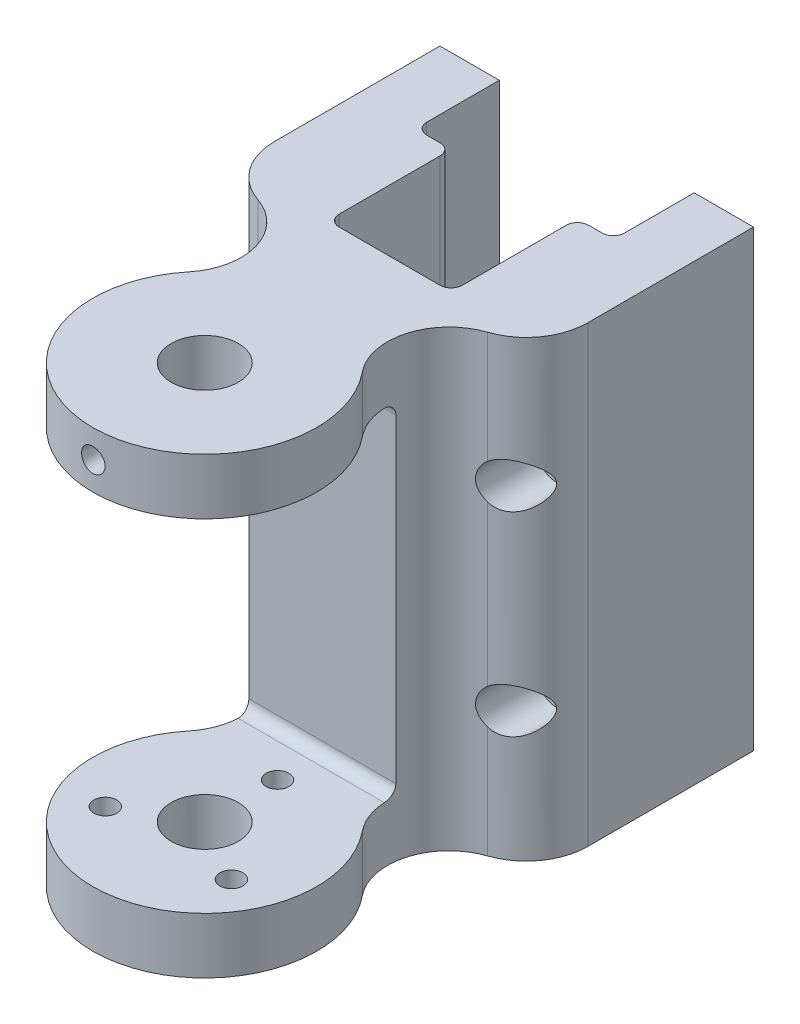
from build123d import *

# Parameters (mm, degrees)
ESQUISSE3_R                         = 3
BOSS_EXTRU_1_DEPTH                  = 20.25
ENL_V_MAT_EXTRU_2_DEPTH             = 55.83668936
ENL_V_MAT_EXTRU_2_DEPTH_BACK        = 55.83668936
ESQUISSE5_W                         = 24.5
ESQUISSE5_H                         = 30.5
ENL_V_MAT_EXTRU_3_DEPTH             = 66.094162565
ENL_V_MAT_EXTRU_3_DEPTH_BACK        = 66.094162565
ENL_V_MAT_EXTRU_6_DEPTH             = 66.094162565
TROU_TARAUD_M2_51_D                 = 2.05
TROU_TARAUD_M2_51_DEPTH             = 5
DIAM_TRE_DU_PER_AGE_2_1_2_1_1_D     = 2.1
DIAM_TRE_DU_PER_AGE_2_1_2_1_1_DEPTH = 1.8
DIAM_TRE_DU_PER_AGE_2_1_2_1_1_TIP   = 0.63090365
ESQUISSE16_R                        = 1.025
ENL_V_MAT_EXTRU_7_DEPTH             = 52.293883791
ENL_V_START                         = -15
ESQUISSE17_R                        = 2
ENL_V_MAT_EXTRU_9_DEPTH             = 10
CONG_1_R                            = 1


with BuildPart() as part:
    # Esquisse3 → Boss.-Extru.1 (new, symmetric)
    with BuildSketch(Plane(origin=(0, 0, 0), x_dir=(1, 0, 0), z_dir=(0, 1, 0))):
        with BuildLine():
            Line((-14, 0), (-14, -35))
            ThreePointArc((-14, -35), (0, -49), (14, -35))
            Line((14, -35), (14, 0))
            Line((14, 0), (-14, 0))
        make_face()
        with Locations(Location((0, -35, 0), (0, 0, 270))):
            Circle(ESQUISSE3_R, mode=Mode.SUBTRACT)
    extrude(amount=BOSS_EXTRU_1_DEPTH, both=True)

    # Esquisse5 → Enlèv. mat.-Extru.2 (cut, two sides: drawn at the far end of the back side and taken through both)
    with BuildSketch(Plane(origin=(0, 0, 0), x_dir=(0, 0, -1), z_dir=(1, 0, 0)).offset(-ENL_V_MAT_EXTRU_2_DEPTH_BACK)):
        with Locations((-36.75, 0)):
            Rectangle(ESQUISSE5_W, ESQUISSE5_H)
    extrude(amount=ENL_V_MAT_EXTRU_2_DEPTH + ENL_V_MAT_EXTRU_2_DEPTH_BACK, mode=Mode.SUBTRACT)

    # Esquisse6 → Enlèv. mat.-Extru.3 (cut, two sides: drawn at the far end of the back side and taken through both)
    with BuildSketch(Plane(origin=(0, -20.25, 0), x_dir=(1, 0, 0), z_dir=(0, 1, 0)).offset(-ENL_V_MAT_EXTRU_3_DEPTH_BACK)):
        Polygon((-8.7, 0), (-8.7, -7.479156707), (-5.5, -7.479156707), (-5.5, -18.5), (5.5, -18.5), (5.5, -7.221861732), (8.7, -7.221861732), (8.7, 0), align=None)
    extrude(amount=ENL_V_MAT_EXTRU_3_DEPTH + ENL_V_MAT_EXTRU_3_DEPTH_BACK, mode=Mode.SUBTRACT)

    # Esquisse11 → Enlèv. mat.-Extru.6 (cut, through all)
    with BuildSketch(Plane.XZ.offset(20.25)):
        with BuildLine():
            Line((14, 14.792740578), (14, 35))
            ThreePointArc((14, 35), (0, 49), (-14, 35))
            Line((-14, 35), (-14, 14.792740578))
            ThreePointArc((-14, 14.792740578), (-12.968272988, 17.999691858), (-10.260168543, 20.003480132))
            ThreePointArc((-10.260168543, 20.003480132), (-6.735867006, 23.689629257), (-7.755056184, 28.686593346))
            ThreePointArc((-7.755056184, 28.686593346), (0, 45), (7.755056184, 28.686593346))
            ThreePointArc((7.755056184, 28.686593346), (6.735867006, 23.689629257), (10.260168543, 20.003480132))
            ThreePointArc((10.260168543, 20.003480132), (12.968272988, 17.999691858), (14, 14.792740578))
        make_face()
    extrude(amount=-ENL_V_MAT_EXTRU_6_DEPTH, mode=Mode.SUBTRACT)

    # Trou taraudé M2.51
    with Locations(Plane.XZ.offset(20.25)):
        with Locations((0, 28.5), (-5.629165125, 38.25), (5.629165125, 38.25)):
            Hole(TROU_TARAUD_M2_51_D / 2, depth=TROU_TARAUD_M2_51_DEPTH)

    # Diamètre du perçage Ø2.1 (2.1)1
    with Locations(Plane.XY.offset(45)):
        with Locations((0, 17.75)):
            Hole(DIAM_TRE_DU_PER_AGE_2_1_2_1_1_D / 2, depth=DIAM_TRE_DU_PER_AGE_2_1_2_1_1_DEPTH)
            with Locations((0, 0, -(DIAM_TRE_DU_PER_AGE_2_1_2_1_1_DEPTH + DIAM_TRE_DU_PER_AGE_2_1_2_1_1_TIP / 2))):  # 118° drill point
                Cone(0, DIAM_TRE_DU_PER_AGE_2_1_2_1_1_D / 2, DIAM_TRE_DU_PER_AGE_2_1_2_1_1_TIP, mode=Mode.SUBTRACT)

    # Esquisse16 → Enlèv. mat.-Extru.7 (cut, through all)
    with BuildSketch(Plane(origin=(0, 0, 0), x_dir=(-1, 0, 0), z_dir=(0, 0, -1))):
        with Locations((-11.5, 8.7)):
            Circle(ESQUISSE16_R)
        with Locations((11.5, 8.7)):
            Circle(ESQUISSE16_R)
        with Locations((-11.5, -8.7)):
            Circle(ESQUISSE16_R)
        with Locations((11.5, -8.7)):
            Circle(ESQUISSE16_R)
    extrude(amount=-ENL_V_MAT_EXTRU_7_DEPTH, mode=Mode.SUBTRACT)

    # Esquisse17 → Enlèv. mat.-Extru.9 (cut)
    with BuildSketch(Plane(origin=(0, 0, 0), x_dir=(-1, 0, 0), z_dir=(0, 0, -1)).offset(ENL_V_START)):
        with Locations((11.5, 8.7)):
            Circle(ESQUISSE17_R)
        with Locations((11.5, -8.7)):
            Circle(ESQUISSE17_R)
        with Locations((-11.5, -8.7)):
            Circle(ESQUISSE17_R)
        with Locations((-11.5, 8.7)):
            Circle(ESQUISSE17_R)
    extrude(amount=-ENL_V_MAT_EXTRU_9_DEPTH, mode=Mode.SUBTRACT)

    # Congé1
    cong_1_edges = [part.edges().sort_by_distance(p)[0] for p in [
        (5.5, 0, 7.221861732),
        (5.5, 0, 18.5),
        (-5.5, 0, 18.5),
        (-5.5, 0, 7.479156707),
        (8.7, 0, 7.221861732),
        (-8.7, 0, 7.479156707),
        (0, 15.25, 24.5),
        (0, -15.25, 24.5),
    ]]
    fillet(cong_1_edges, radius=CONG_1_R)


solid = part.part
